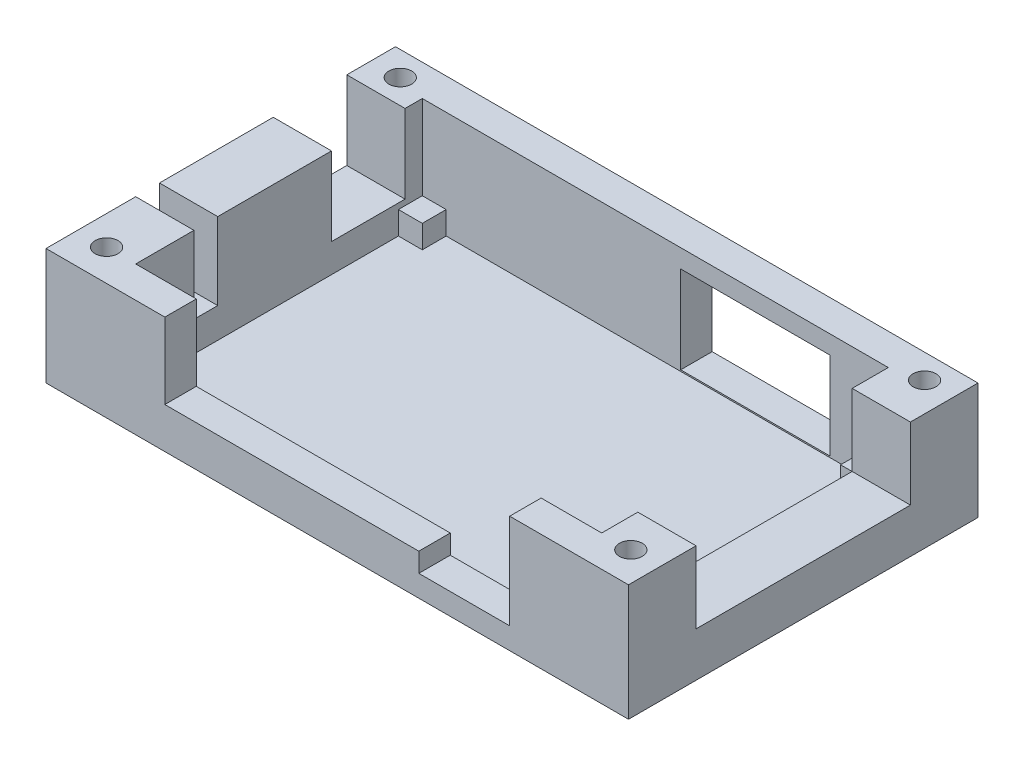
from build123d import *

# Parameters (mm, degrees)
CROQUIS1_W              = 127
CROQUIS1_H              = 76.2
SALIENTE_EXTRUIR1_DEPTH = 25.4
CROQUIS2_W              = 101.6
CROQUIS2_H              = 62.484
CORTAR_EXTRUIR1_DEPTH   = 23.368
CORTAR_EXTRUIR2_REACH   = 137.003
CROQUIS3_W              = 46.736
CROQUIS3_H              = 15.688547189
CORTAR_EXTRUIR3_REACH   = 104.391
CORTAR_EXTRUIR4_REACH   = 137.003
CROQUIS5_W              = 5.1816
CROQUIS5_H              = 16.8021
CROQUIS5_W_2            = 16.03502
CROQUIS5_H_2            = 17.1196
CORTAR_EXTRUIR5_REACH   = 104.391
CROQUIS6_W              = 32.5628
CROQUIS6_H              = 19.05
CROQUIS7_R              = 2.4892
CORTAR_EXTRUIR6_DEPTH   = 79.288057838
CROQUIS8_W              = 5.207
CROQUIS8_H              = 5.207
SALIENTE_EXTRUIR2_DEPTH = 5.0038


with BuildPart() as part:
    # Croquis1 → Saliente-Extruir1 (new body)
    with BuildSketch(Plane(origin=(0, 0, 0), x_dir=(1, 0, 0), z_dir=(0, 1, 0))):
        Rectangle(CROQUIS1_W, CROQUIS1_H)
    extrude(amount=SALIENTE_EXTRUIR1_DEPTH)

    # Croquis2 → Cortar-Extruir1 (cut)
    with BuildSketch(Plane(origin=(0, 25.4, 0), x_dir=(1, 0, 0), z_dir=(0, 1, 0))):
        Rectangle(CROQUIS2_W, CROQUIS2_H)
    extrude(amount=-CORTAR_EXTRUIR1_DEPTH, mode=Mode.SUBTRACT)

    # Croquis3 → Cortar-Extruir2 (cut, up to next)
    with BuildSketch(Plane(origin=(63.5, 0, 0), x_dir=(0, 0, -1), z_dir=(1, 0, 0)), mode=Mode.PRIVATE) as cortar_extruir2_sk1:
        with Locations((0, 17.555726406)):
            Rectangle(CROQUIS3_W, CROQUIS3_H)
    cortar_extruir2_tool1 = extrude(cortar_extruir2_sk1.sketch, amount=-CORTAR_EXTRUIR2_REACH, mode=Mode.PRIVATE) & part.part
    add(cortar_extruir2_tool1.solids().sort_by_distance((63.5, 17.555726, 0))[0], mode=Mode.SUBTRACT)

    # Croquis4 → Cortar-Extruir3 (cut, up to next)
    with BuildSketch(Plane.XY.offset(38.1), mode=Mode.PRIVATE) as cortar_extruir3_sk1:
        Polygon((-37.592, 8.89), (17.78, 8.89), (17.78, 4.699), (37.592, 4.699), (37.592, 8.89), (37.592, 25.4), (-37.592, 25.4), align=None)
    cortar_extruir3_tool1 = extrude(cortar_extruir3_sk1.sketch, amount=-CORTAR_EXTRUIR3_REACH, mode=Mode.PRIVATE) & part.part
    add(cortar_extruir3_tool1.solids().sort_by_distance((1.735854, 16.496045, 38.1))[0], mode=Mode.SUBTRACT)

    # Croquis5 → Cortar-Extruir4 (cut, up to next)
    with BuildSketch(Plane.ZY.offset(63.5), mode=Mode.PRIVATE) as cortar_extruir4_sk1:
        with Locations((15.9512, 16.99895)):
            Rectangle(CROQUIS5_W, CROQUIS5_H)
    cortar_extruir4_tool1 = extrude(cortar_extruir4_sk1.sketch, amount=-CORTAR_EXTRUIR4_REACH, mode=Mode.PRIVATE) & part.part
    # Croquis5 → Cortar-Extruir4 (cut, up to next)
    with BuildSketch(Plane.ZY.offset(63.5), mode=Mode.PRIVATE) as cortar_extruir4_sk2:
        with Locations((-19.46529, 16.8402)):
            Rectangle(CROQUIS5_W_2, CROQUIS5_H_2)
    cortar_extruir4_tool2 = extrude(cortar_extruir4_sk2.sketch, amount=-CORTAR_EXTRUIR4_REACH, mode=Mode.PRIVATE) & part.part
    add(cortar_extruir4_tool1.solids().sort_by_distance((-63.5, 16.99895, 15.9512))[0], mode=Mode.SUBTRACT)
    add(cortar_extruir4_tool2.solids().sort_by_distance((-63.5, 16.8402, -19.46529))[0], mode=Mode.SUBTRACT)

    # Croquis6 → Cortar-Extruir5 (cut, up to next)
    with BuildSketch(Plane(origin=(0, 0, -38.1), x_dir=(-1, 0, 0), z_dir=(0, 0, -1)), mode=Mode.PRIVATE) as cortar_extruir5_sk1:
        with Locations((-21.8186, 11.8618)):
            Rectangle(CROQUIS6_W, CROQUIS6_H)
    cortar_extruir5_tool1 = extrude(cortar_extruir5_sk1.sketch, amount=-CORTAR_EXTRUIR5_REACH, mode=Mode.PRIVATE) & part.part
    add(cortar_extruir5_tool1.solids().sort_by_distance((21.8186, 11.8618, -38.1))[0], mode=Mode.SUBTRACT)

    # Croquis7 → Cortar-Extruir6 (cut, through all)
    with BuildSketch(Plane(origin=(0, 25.4, 0), x_dir=(1, 0, 0), z_dir=(0, 1, 0))):
        with BuildLine():
            ThreePointArc((-54.6608, 32.7914), (-57.15, 35.2806), (-59.6392, 32.7914))
            Line((-59.6392, 32.7914), (-54.6608, 32.7914))
        make_face()
        with BuildLine():
            Line((-54.6608, 32.7914), (-59.6392, 32.7914))
            ThreePointArc((-59.6392, 32.7914), (-57.15, 30.3022), (-54.6608, 32.7914))
        make_face()
        with Locations(Location((-57.15, -31.242, 0), (0, 0, 270))):
            Circle(CROQUIS7_R)
        with Locations(Location((57.15, 32.7914, 0), (0, 0, 270))):
            Circle(CROQUIS7_R)
        with Locations(Location((57.15, -31.242, 0), (0, 0, 270))):
            Circle(CROQUIS7_R)
    extrude(amount=-CORTAR_EXTRUIR6_DEPTH, mode=Mode.SUBTRACT)

    # Croquis8 → Saliente-Extruir2 (add)
    with BuildSketch(Plane(origin=(0, 2.032, 0), x_dir=(1, 0, 0), z_dir=(0, 1, 0))):
        with Locations((-48.1965, 28.6385)):
            Rectangle(CROQUIS8_W, CROQUIS8_H)
        with Locations((-48.1965, -28.6385)):
            Rectangle(CROQUIS8_W, CROQUIS8_H)
        with Locations((48.1965, -28.6385)):
            Rectangle(CROQUIS8_W, CROQUIS8_H)
        with Locations((48.1965, 28.6385)):
            Rectangle(CROQUIS8_W, CROQUIS8_H)
    extrude(amount=SALIENTE_EXTRUIR2_DEPTH)


solid = part.part
